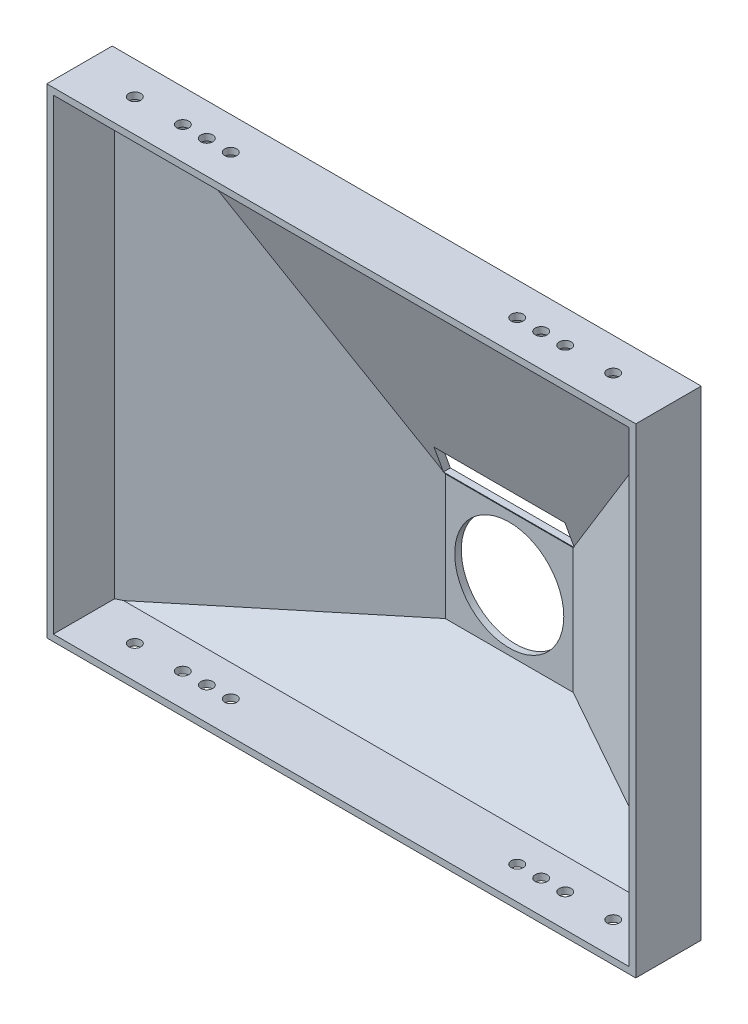
from build123d import *

# Parameters (mm, degrees)
EXTRUDE_1_REACH          = 233.355
SKETCH_5_W               = 270
SKETCH_5_H               = 220
SHELL_1_T                = -3
SKETCH_3_R               = 25
CUT_EXTRUDE_1_DEPTH      = 10
SKETCH_4_W               = 60
SKETCH_4_H               = 12
CUT_EXTRUDE_2_DEPTH      = 30
SKETCH_6_R               = 2.75
CUT_EXTRUDE_3_DEPTH      = 10
MIRROR_2_COPY_1_SKETCH_R = 2.75
MIRROR_2_COPY_1_DEPTH    = 10


with BuildPart() as part:
    # 草图2 → 放样2 section 0
    with BuildSketch(Plane.XY.offset(50)):
        with BuildLine():
            Line((-135, 170), (135, 170))
            Line((135, 170), (135, -50))
            Line((135, -50), (-135, -50))
            Line((-135, -50), (-135, 170))
        make_face()
    # 草图1 → 放样2 section 1
    with BuildSketch(Plane.XY):
        with BuildLine():
            Line((-30, 30), (30, 30))
            Line((30, 30), (30, -30))
            Line((30, -30), (-30, -30))
            Line((-30, -30), (-30, 30))
        make_face()
    loft()

    # 草图5 → 凸台-拉伸1 (add, up to next)
    with BuildSketch(Plane.XY.offset(80), mode=Mode.PRIVATE) as extrude_1_sk1:
        with Locations((0, 60)):
            Rectangle(SKETCH_5_W, SKETCH_5_H)
    extrude_1_tool1 = extrude(extrude_1_sk1.sketch, amount=-EXTRUDE_1_REACH, mode=Mode.PRIVATE) - part.part
    add(extrude_1_tool1.solids().sort_by_distance((0, 60, 80))[0])

    # 抽壳1
    shell_1_openings = [part.faces().sort_by_distance(p)[0] for p in [
        (0, 60, 80),
    ]]
    offset(amount=SHELL_1_T, openings=shell_1_openings)

    # 草图3 → 切除-拉伸1 (cut)
    with BuildSketch(Plane.XY.offset(3)):
        Circle(SKETCH_3_R)
    extrude(amount=-CUT_EXTRUDE_1_DEPTH, mode=Mode.SUBTRACT)

    # 草图4 → 切除-拉伸2 (cut)
    with BuildSketch(Plane(origin=(0, 0, 0), x_dir=(-1, 0, 0), z_dir=(0, 0, -1))):
        with Locations((0, 36)):
            Rectangle(SKETCH_4_W, SKETCH_4_H)
    extrude(amount=-CUT_EXTRUDE_2_DEPTH, mode=Mode.SUBTRACT)

    # 草图6 → 切除-拉伸3 (cut)
    with BuildSketch(Plane.XZ.offset(50)):
        with Locations(Location((65.65, 65, 0), (0, 0, 270))):
            Circle(SKETCH_6_R)
        with Locations(Location((76.65, 65, 0), (0, 0, 270))):
            Circle(SKETCH_6_R)
        with Locations(Location((87.65, 65, 0), (0, 0, 270))):
            Circle(SKETCH_6_R)
        with Locations(Location((109.65, 65, 0), (0, 0, 270))):
            Circle(SKETCH_6_R)
    cut_extrude_3 = extrude(amount=-CUT_EXTRUDE_3_DEPTH, mode=Mode.SUBTRACT)

    # 镜向1: 切除-拉伸3 across plane
    add(cut_extrude_3.mirror(Plane(origin=(0, 60, 0), x_dir=(0, 0, 1), z_dir=(0, -1, 0))), mode=Mode.SUBTRACT)

    # 镜向2: 切除-拉伸3 across plane
    add(cut_extrude_3.mirror(Plane(origin=(0, 0, 0), x_dir=(0, 0, 1), z_dir=(1, 0, 0))), mode=Mode.SUBTRACT)

    # 镜向2 copy 1 sketch → 镜向2 copy 1 (cut)
    with BuildSketch(Plane(origin=(0, 170, 0), x_dir=(-1, 0, 0), z_dir=(0, 1, 0))):
        with Locations(Location((65.65, 65, 0), (0, 0, 270))):
            Circle(MIRROR_2_COPY_1_SKETCH_R)
        with Locations(Location((76.65, 65, 0), (0, 0, 270))):
            Circle(MIRROR_2_COPY_1_SKETCH_R)
        with Locations(Location((87.65, 65, 0), (0, 0, 270))):
            Circle(MIRROR_2_COPY_1_SKETCH_R)
        with Locations(Location((109.65, 65, 0), (0, 0, 270))):
            Circle(MIRROR_2_COPY_1_SKETCH_R)
    extrude(amount=-MIRROR_2_COPY_1_DEPTH, mode=Mode.SUBTRACT)


solid = part.part
